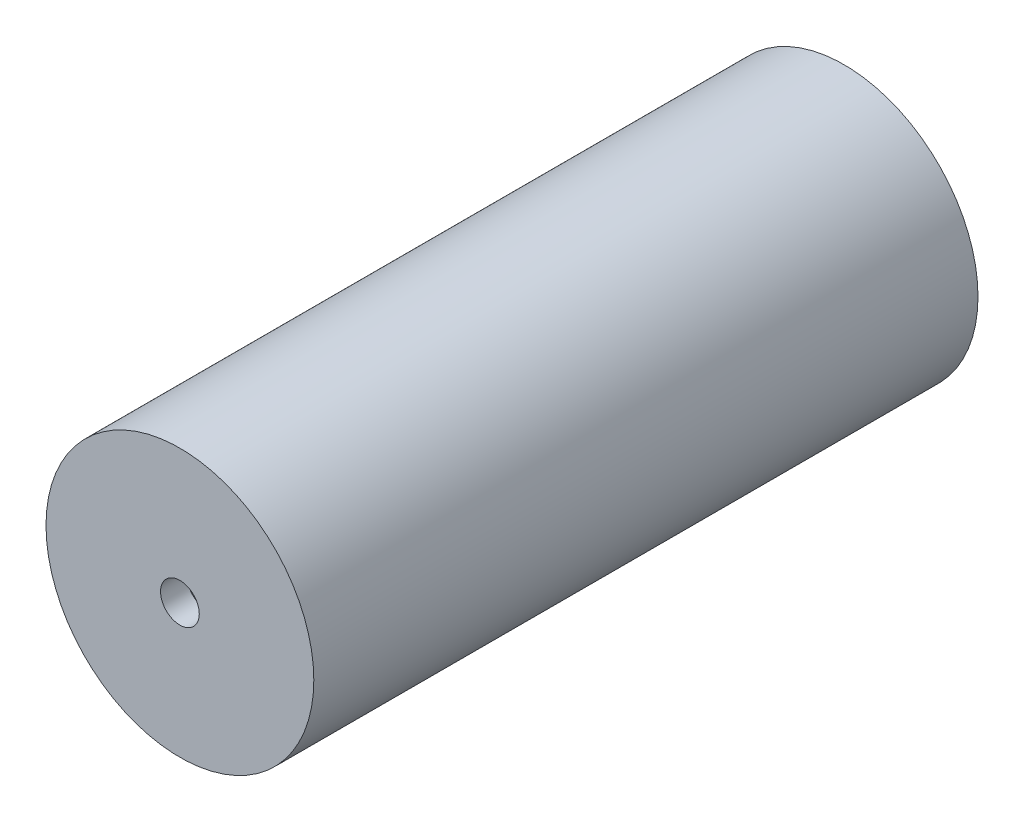
from build123d import *

# Parameters (mm, degrees)
SKETCH1_R           = 252
BOSS_EXTRUDE1_DEPTH = 50
SKETCH2_R           = 252
SKETCH2_R_2         = 202
BOSS_EXTRUDE2_DEPTH = 1149.92
SKETCH3_R           = 252
BOSS_EXTRUDE3_DEPTH = 50
SKETCH4_R           = 36.45
CUT_EXTRUDE1_DEPTH  = 1300.733821365


with BuildPart() as part:
    # Sketch1 → Boss-Extrude1 (new body)
    with BuildSketch(Plane.XY):
        Circle(SKETCH1_R)
    extrude(amount=BOSS_EXTRUDE1_DEPTH)

    # Sketch2 → Boss-Extrude2 (add)
    with BuildSketch(Plane.XY.offset(50)):
        Circle(SKETCH2_R)
        Circle(SKETCH2_R_2, mode=Mode.SUBTRACT)
    extrude(amount=BOSS_EXTRUDE2_DEPTH)

    # Sketch3 → Boss-Extrude3 (add)
    with BuildSketch(Plane.XY.offset(1199.92)):
        Circle(SKETCH3_R)
    extrude(amount=BOSS_EXTRUDE3_DEPTH)

    # Sketch4 → Cut-Extrude1 (cut, through all)
    with BuildSketch(Plane.XY.offset(1249.92)):
        Circle(SKETCH4_R)
    extrude(amount=-CUT_EXTRUDE1_DEPTH, mode=Mode.SUBTRACT)


solid = part.part
